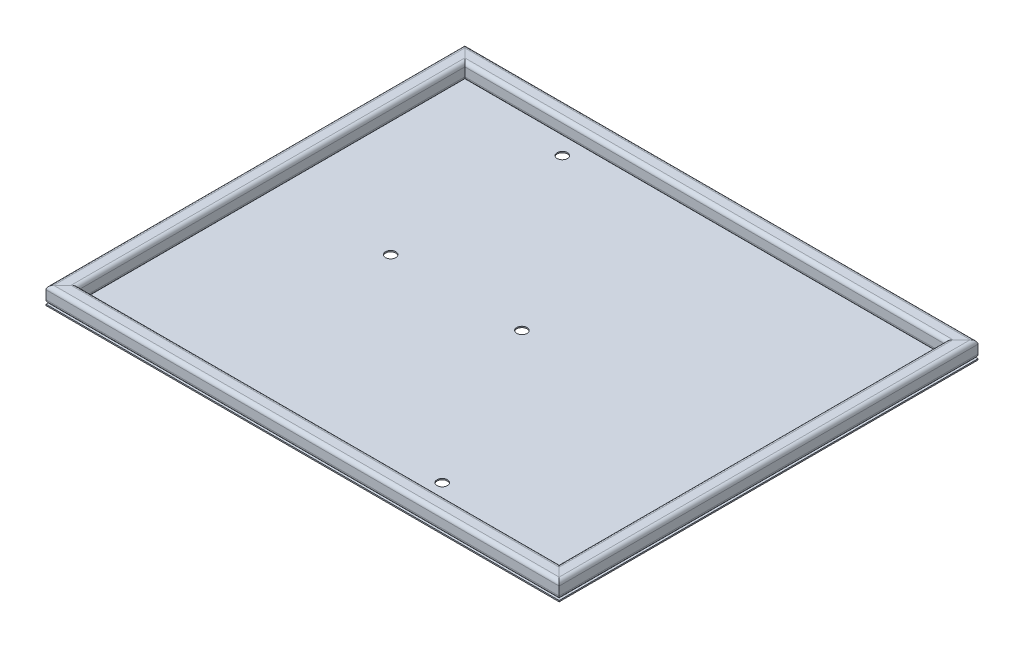
from build123d import *

# Parameters (mm, degrees)
TUBO_CUADRADO_2_X_2_X_0_25_1_DEPTH      = 686.921024484
TUBO_CUADRADO_2_X_2_X_0_25_1_DEPTH_BACK = 36.921024484
TUBO_CUADRADO_2_X_2_X_0_25_1_2_DEPTH    = 870.242048969
TUBO_CUADRADO_2_X_2_X_0_25_1_3_DEPTH    = 723.842048969
TUBO_CUADRADO_2_X_2_X_0_25_1_4_DEPTH    = 870.242048969
CROQUIS3_W                              = 796.4
CROQUIS3_H                              = 650
SALIENTE_EXTRUIR1_DEPTH                 = 1.9
CROQUIS5_R                              = 8
CORTAR_EXTRUIR1_DEPTH                   = 10


with BuildPart() as part:
    # Sketch1 → Tubo cuadrado 2 X 2 X 0.25(1) (new, two sides: drawn at the far end of the back side and taken through both)
    with BuildSketch(Plane(origin=(-385.5, 12.7, -325), x_dir=(1, 0, 0), z_dir=(0, 0, 1)).offset(-TUBO_CUADRADO_2_X_2_X_0_25_1_DEPTH_BACK)):
        with BuildLine():
            Line((-6.7, -12.7), (6.7, -12.7))
            ThreePointArc((6.7, -12.7), (10.942640687, -10.942640687), (12.7, -6.7))
            Line((12.7, -6.7), (12.7, 6.7))
            ThreePointArc((12.7, 6.7), (10.942640687, 10.942640687), (6.7, 12.7))
            Line((6.7, 12.7), (-6.7, 12.7))
            ThreePointArc((-6.7, 12.7), (-10.942640687, 10.942640687), (-12.7, 6.7))
            Line((-12.7, 6.7), (-12.7, -6.7))
            ThreePointArc((-12.7, -6.7), (-10.942640687, -10.942640687), (-6.7, -12.7))
        make_face()
        with BuildLine():
            Line((-6.7, -9.7), (6.7, -9.7))
            ThreePointArc((6.7, -9.7), (8.821320344, -8.821320344), (9.7, -6.7))
            Line((9.7, -6.7), (9.7, 6.7))
            ThreePointArc((9.7, 6.7), (8.821320344, 8.821320344), (6.7, 9.7))
            Line((6.7, 9.7), (-6.7, 9.7))
            ThreePointArc((-6.7, 9.7), (-8.821320344, 8.821320344), (-9.7, 6.7))
            Line((-9.7, 6.7), (-9.7, -6.7))
            ThreePointArc((-9.7, -6.7), (-8.821320344, -8.821320344), (-6.7, -9.7))
        make_face(mode=Mode.SUBTRACT)
    extrude(amount=TUBO_CUADRADO_2_X_2_X_0_25_1_DEPTH + TUBO_CUADRADO_2_X_2_X_0_25_1_DEPTH_BACK)

    # Tubo cuadrado 2 X 2 X 0.25(1) mitre 1
    split(bisect_by=Plane(origin=(-398.2, 0, -325), x_dir=(0, -1, 0), z_dir=(-0.707106781, 0, 0.707106781)), keep=Keep.TOP)

    # Tubo cuadrado 2 X 2 X 0.25(1) mitre 2
    split(bisect_by=Plane(origin=(-398.2, 0, 325), x_dir=(0, -1, 0), z_dir=(-0.707106781, 0, -0.707106781)), keep=Keep.TOP)


with BuildPart() as body_2:
    # Sketch1 on segment 2 (carried to segment 2) → Tubo cuadrado 2 X 2 X 0.25_1 2 (new body)
    with BuildSketch(Plane(origin=(-435.121024484, 12.7, 312.3), x_dir=(0, 0, -1), z_dir=(1, 0, 0))):
        with BuildLine():
            Line((-6.7, -12.7), (6.7, -12.7))
            ThreePointArc((6.7, -12.7), (10.942640687, -10.942640687), (12.7, -6.7))
            Line((12.7, -6.7), (12.7, 6.7))
            ThreePointArc((12.7, 6.7), (10.942640687, 10.942640687), (6.7, 12.7))
            Line((6.7, 12.7), (-6.7, 12.7))
            ThreePointArc((-6.7, 12.7), (-10.942640687, 10.942640687), (-12.7, 6.7))
            Line((-12.7, 6.7), (-12.7, -6.7))
            ThreePointArc((-12.7, -6.7), (-10.942640687, -10.942640687), (-6.7, -12.7))
        make_face()
        with BuildLine():
            Line((-6.7, -9.7), (6.7, -9.7))
            ThreePointArc((6.7, -9.7), (8.821320344, -8.821320344), (9.7, -6.7))
            Line((9.7, -6.7), (9.7, 6.7))
            ThreePointArc((9.7, 6.7), (8.821320344, 8.821320344), (6.7, 9.7))
            Line((6.7, 9.7), (-6.7, 9.7))
            ThreePointArc((-6.7, 9.7), (-8.821320344, 8.821320344), (-9.7, 6.7))
            Line((-9.7, 6.7), (-9.7, -6.7))
            ThreePointArc((-9.7, -6.7), (-8.821320344, -8.821320344), (-6.7, -9.7))
        make_face(mode=Mode.SUBTRACT)
    extrude(amount=TUBO_CUADRADO_2_X_2_X_0_25_1_2_DEPTH)

    # Tubo cuadrado 2 X 2 X 0.25_1 2 mitre 1
    split(bisect_by=Plane(origin=(-398.2, 0, 325), x_dir=(0, 1, 0), z_dir=(0.707106781, 0, 0.707106781)), keep=Keep.TOP)

    # Tubo cuadrado 2 X 2 X 0.25_1 2 mitre 2
    split(bisect_by=Plane(origin=(398.2, 0, 325), x_dir=(0, -1, 0), z_dir=(-0.707106781, 0, 0.707106781)), keep=Keep.TOP)


with BuildPart() as body_3:
    # Sketch1 on segment 3 (carried to segment 3) → Tubo cuadrado 2 X 2 X 0.25_1 3 (new body)
    with BuildSketch(Plane(origin=(385.5, 12.7, 361.921024484), x_dir=(-1, 0, 0), z_dir=(0, 0, -1))):
        with BuildLine():
            Line((-6.7, -12.7), (6.7, -12.7))
            ThreePointArc((6.7, -12.7), (10.942640687, -10.942640687), (12.7, -6.7))
            Line((12.7, -6.7), (12.7, 6.7))
            ThreePointArc((12.7, 6.7), (10.942640687, 10.942640687), (6.7, 12.7))
            Line((6.7, 12.7), (-6.7, 12.7))
            ThreePointArc((-6.7, 12.7), (-10.942640687, 10.942640687), (-12.7, 6.7))
            Line((-12.7, 6.7), (-12.7, -6.7))
            ThreePointArc((-12.7, -6.7), (-10.942640687, -10.942640687), (-6.7, -12.7))
        make_face()
        with BuildLine():
            Line((-6.7, -9.7), (6.7, -9.7))
            ThreePointArc((6.7, -9.7), (8.821320344, -8.821320344), (9.7, -6.7))
            Line((9.7, -6.7), (9.7, 6.7))
            ThreePointArc((9.7, 6.7), (8.821320344, 8.821320344), (6.7, 9.7))
            Line((6.7, 9.7), (-6.7, 9.7))
            ThreePointArc((-6.7, 9.7), (-8.821320344, 8.821320344), (-9.7, 6.7))
            Line((-9.7, 6.7), (-9.7, -6.7))
            ThreePointArc((-9.7, -6.7), (-8.821320344, -8.821320344), (-6.7, -9.7))
        make_face(mode=Mode.SUBTRACT)
    extrude(amount=TUBO_CUADRADO_2_X_2_X_0_25_1_3_DEPTH)

    # Tubo cuadrado 2 X 2 X 0.25_1 3 mitre 1
    split(bisect_by=Plane(origin=(398.2, 0, -325), x_dir=(0, 1, 0), z_dir=(0.707106781, 0, 0.707106781)), keep=Keep.TOP)

    # Tubo cuadrado 2 X 2 X 0.25_1 3 mitre 2
    split(bisect_by=Plane(origin=(398.2, 0, 325), x_dir=(0, 1, 0), z_dir=(0.707106781, 0, -0.707106781)), keep=Keep.TOP)


with BuildPart() as body_4:
    # Sketch1 on segment 4 (carried to segment 4) → Tubo cuadrado 2 X 2 X 0.25_1 4 (new body)
    with BuildSketch(Plane(origin=(435.121024484, 12.7, -312.3), x_dir=(0, 0, 1), z_dir=(-1, 0, 0))):
        with BuildLine():
            Line((-6.7, -12.7), (6.7, -12.7))
            ThreePointArc((6.7, -12.7), (10.942640687, -10.942640687), (12.7, -6.7))
            Line((12.7, -6.7), (12.7, 6.7))
            ThreePointArc((12.7, 6.7), (10.942640687, 10.942640687), (6.7, 12.7))
            Line((6.7, 12.7), (-6.7, 12.7))
            ThreePointArc((-6.7, 12.7), (-10.942640687, 10.942640687), (-12.7, 6.7))
            Line((-12.7, 6.7), (-12.7, -6.7))
            ThreePointArc((-12.7, -6.7), (-10.942640687, -10.942640687), (-6.7, -12.7))
        make_face()
        with BuildLine():
            Line((-6.7, -9.7), (6.7, -9.7))
            ThreePointArc((6.7, -9.7), (8.821320344, -8.821320344), (9.7, -6.7))
            Line((9.7, -6.7), (9.7, 6.7))
            ThreePointArc((9.7, 6.7), (8.821320344, 8.821320344), (6.7, 9.7))
            Line((6.7, 9.7), (-6.7, 9.7))
            ThreePointArc((-6.7, 9.7), (-8.821320344, 8.821320344), (-9.7, 6.7))
            Line((-9.7, 6.7), (-9.7, -6.7))
            ThreePointArc((-9.7, -6.7), (-8.821320344, -8.821320344), (-6.7, -9.7))
        make_face(mode=Mode.SUBTRACT)
    extrude(amount=TUBO_CUADRADO_2_X_2_X_0_25_1_4_DEPTH)

    # Tubo cuadrado 2 X 2 X 0.25_1 4 mitre 1
    split(bisect_by=Plane(origin=(-398.2, 0, -325), x_dir=(0, 1, 0), z_dir=(0.707106781, 0, -0.707106781)), keep=Keep.TOP)

    # Tubo cuadrado 2 X 2 X 0.25_1 4 mitre 2
    split(bisect_by=Plane(origin=(398.2, 0, -325), x_dir=(0, -1, 0), z_dir=(-0.707106781, 0, -0.707106781)), keep=Keep.TOP)


with BuildPart() as body_5:
    # Croquis3 → Saliente-Extruir1 (new body)
    with BuildSketch(Plane.XZ):
        Rectangle(CROQUIS3_W, CROQUIS3_H)
    extrude(amount=SALIENTE_EXTRUIR1_DEPTH)

    # Croquis5 → Cortar-Extruir1 (cut)
    with BuildSketch(Plane(origin=(0, 0, 0), x_dir=(1, 0, 0), z_dir=(0, 1, 0))):
        with Locations(Location((149.099999998, -257.372933, 0), (0, 0, 180))):
            Circle(CROQUIS5_R)
        with Locations(Location((6.349999921, 9.025, 0), (0, 0, 180))):
            Circle(CROQUIS5_R)
        with Locations(Location((-197.299999999, 9.025, 0), (0, 0, 180))):
            Circle(CROQUIS5_R)
        with Locations(Location((-197.299999999, 275.422795334, 0), (0, 0, 180))):
            Circle(CROQUIS5_R)
    extrude(amount=-CORTAR_EXTRUIR1_DEPTH, mode=Mode.SUBTRACT)


solid = Compound([part.part, body_2.part, body_3.part, body_4.part, body_5.part])
